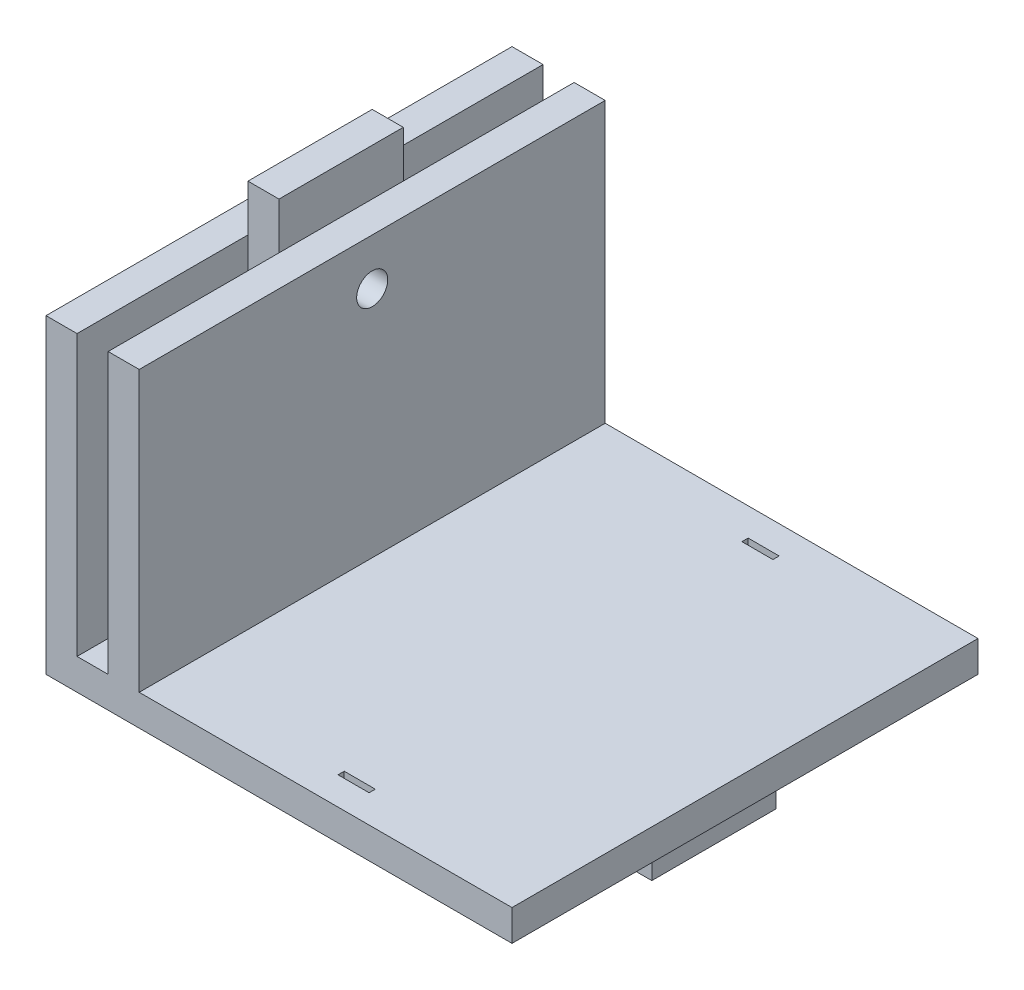
from build123d import *

# Parameters (mm, degrees)
BOSS_EXTRUDE1_DEPTH   = 150
SKETCH3_W             = 10
SKETCH3_H             = 2
CUT_EXTRUDE1_DEPTH    = 10
BOSS_EXTRUDE2_DEPTH   = 10
SKETCH5_R             = 5
CUT_EXTRUDE2_DEPTH    = 217.564078277
SKETCH6_W             = 20
SKETCH6_H             = 40
BOSS_EXTRUDE5_DEPTH   = 15
BOSS_EXTRUDE5_2_DEPTH = 15
CUT_EXTRUDE3_DEPTH    = 204.776838723
CUT_EXTRUDE4_DEPTH    = 204.776838723
SKETCH11_W            = 10
SKETCH11_H            = 40
BOSS_EXTRUDE7_DEPTH   = 15


with BuildPart() as part:
    # Sketch1 → Boss-Extrude1 (new body)
    with BuildSketch(Plane.XY):
        Polygon((20, 100), (20, 10), (10, 10), (10, 100), (0, 100), (0, 10), (0, 0), (10, 0), (150, 0), (150, 10), (30, 10), (30, 100), align=None)
    extrude(amount=BOSS_EXTRUDE1_DEPTH)

    # Sketch3 → Cut-Extrude1 (cut)
    with BuildSketch(Plane(origin=(0, 10, 0), x_dir=(1, 0, 0), z_dir=(0, 1, 0))):
        with Locations((90, -10)):
            Rectangle(SKETCH3_W, SKETCH3_H)
        with Locations((90, -140)):
            Rectangle(SKETCH3_W, SKETCH3_H)
    extrude(amount=-CUT_EXTRUDE1_DEPTH, mode=Mode.SUBTRACT)


with BuildPart() as body_2:
    # Sketch4 → Boss-Extrude2 (new body)
    with BuildSketch(Plane.ZY.offset(-20)):
        with BuildLine():
            Line((95, 100), (55, 100))
            Line((55, 100), (55, 65))
            ThreePointArc((55, 65), (75, 45), (95, 65))
            Line((95, 65), (95, 100))
        make_face()
    extrude(amount=BOSS_EXTRUDE2_DEPTH)


with BuildPart() as cut_extrude2_tool:
    # Sketch5 → Cut-Extrude2 (new, through all)
    with BuildSketch(Plane(origin=(30, 0, 0), x_dir=(0, 0, -1), z_dir=(1, 0, 0))):
        with Locations(Location((-75, 85, 0), (0, 0, 180))):
            Circle(SKETCH5_R)
    extrude(amount=-CUT_EXTRUDE2_DEPTH)


with BuildPart() as part_1:
    add(part.part)

    # Cut-Extrude2: cut by cut_extrude2_tool
    add(cut_extrude2_tool.part, mode=Mode.SUBTRACT)


with BuildPart() as body_2_1:
    add(body_2.part)

    # Cut-Extrude2: cut by cut_extrude2_tool
    add(cut_extrude2_tool.part, mode=Mode.SUBTRACT)

    # Sketch11 → Boss-Extrude7 (add)
    with BuildSketch(Plane(origin=(0, 100, 0), x_dir=(1, 0, 0), z_dir=(0, 1, 0))):
        with Locations((15, -75)):
            Rectangle(SKETCH11_W, SKETCH11_H)
    extrude(amount=BOSS_EXTRUDE7_DEPTH)


with BuildPart() as body_3:
    # Sketch6 → Boss-Extrude5 (new body)
    with BuildSketch(Plane.XZ):
        with Locations((20, 75)):
            Rectangle(SKETCH6_W, SKETCH6_H)
    extrude(amount=BOSS_EXTRUDE5_DEPTH)

    # Sketch7 → Cut-Extrude3 (cut, through all)
    with BuildSketch(Plane.XY.offset(95)):
        with BuildLine():
            Line((22.5, -15), (22.5, -13))
            ThreePointArc((22.5, -13), (20, -3.669872981), (17.5, -13))
            Line((17.5, -13), (17.5, -15))
            Line((17.5, -15), (22.5, -15))
        make_face()
    extrude(amount=-CUT_EXTRUDE3_DEPTH, mode=Mode.SUBTRACT)


with BuildPart() as body_4:
    # Sketch6 → Boss-Extrude5 2 (new body)
    with BuildSketch(Plane.XZ):
        with Locations((130, 75)):
            Rectangle(SKETCH6_W, SKETCH6_H)
    extrude(amount=BOSS_EXTRUDE5_2_DEPTH)

    # Sketch10 → Cut-Extrude4 (cut, through all)
    with BuildSketch(Plane.XY.offset(95)):
        with BuildLine():
            Line((127.5, -15), (132.5, -15))
            Line((132.5, -15), (132.5, -13))
            ThreePointArc((132.5, -13), (130, -3.669872981), (127.5, -13))
            Line((127.5, -13), (127.5, -15))
        make_face()
    extrude(amount=-CUT_EXTRUDE4_DEPTH, mode=Mode.SUBTRACT)


solid = Compound([part_1.part, body_2_1.part, body_3.part, body_4.part])
